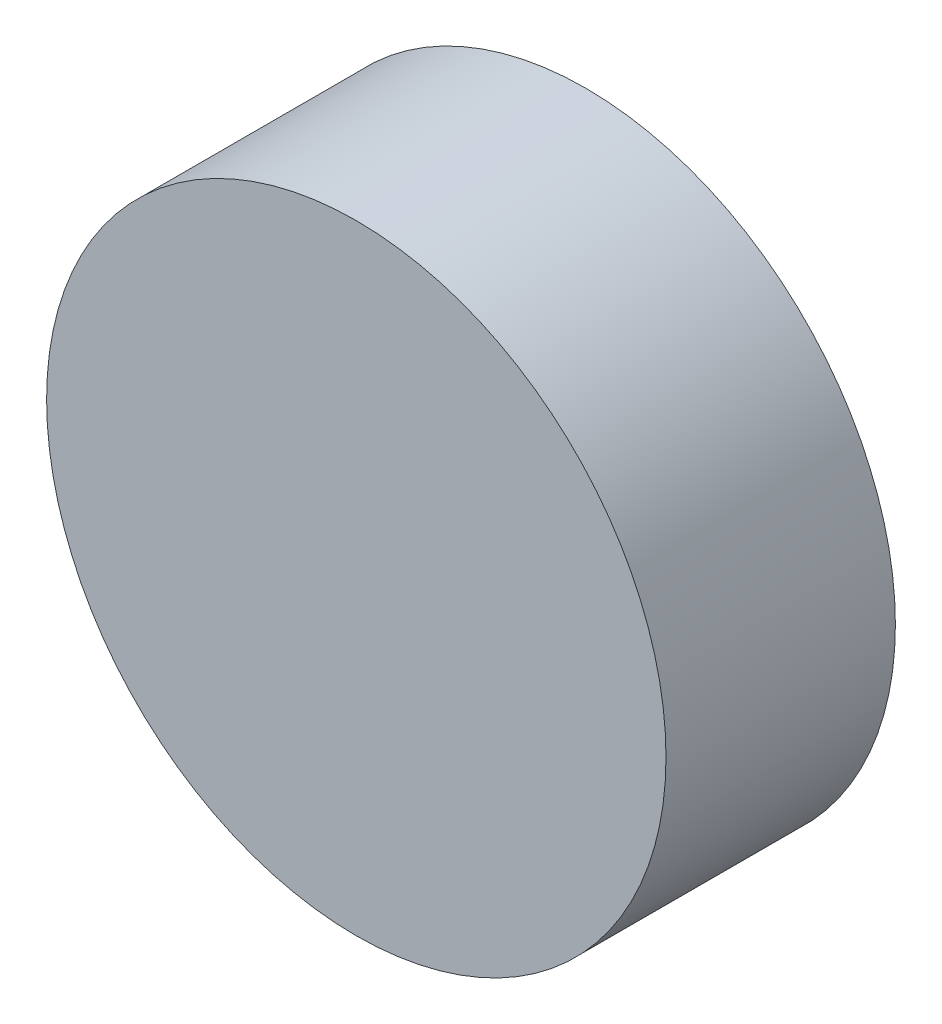
from build123d import *

# Parameters (mm, degrees)
ESQUISSE1_R          = 13.5
BASE_EXTRUSION_DEPTH = 10


with BuildPart() as part:
    # Esquisse1 → Base-Extrusion (new body)
    with BuildSketch(Plane.XY):
        Circle(ESQUISSE1_R)
    extrude(amount=BASE_EXTRUSION_DEPTH)


solid = part.part
